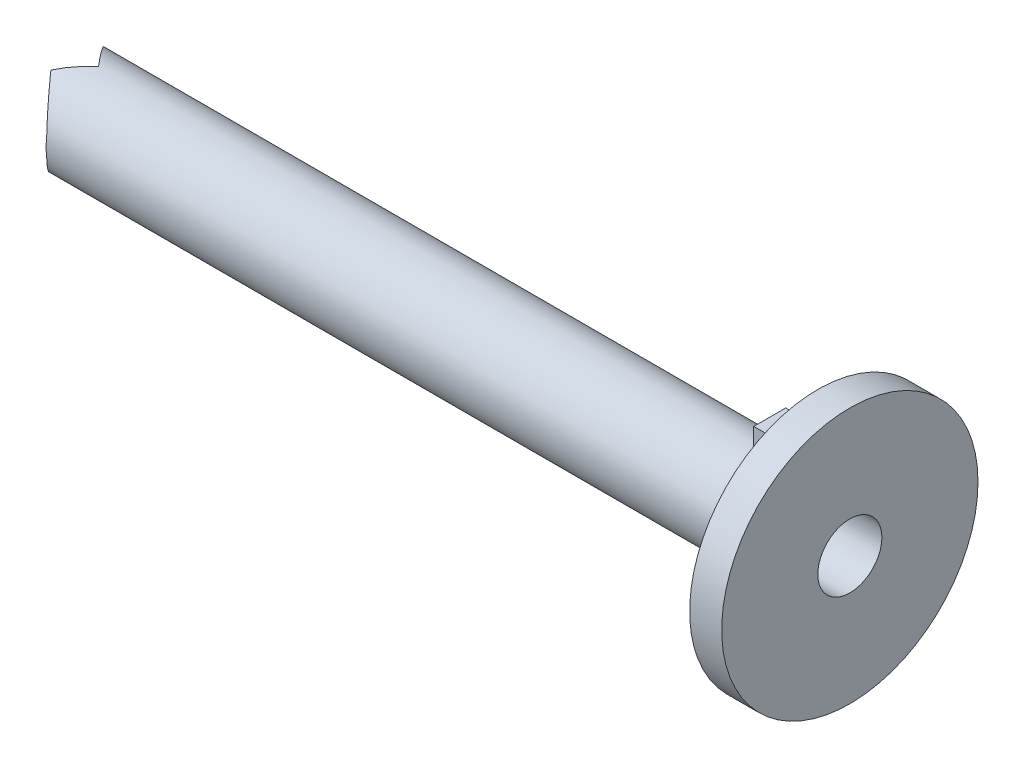
from build123d import *

# Parameters (mm, degrees)
SKETCH1_R                = 19.05
SKETCH1_R_2              = 12.7
BOSS_EXTRUDE1_DEPTH      = 381
SKETCH2_R                = 50.8
SKETCH2_R_2              = 12.7
BOSS_EXTRUDE2_DEPTH      = 12.7
CUT_EXTRUDE1_DEPTH       = 388.714173071
CUT_EXTRUDE1_DEPTH_BACK  = 388.714173071
BOSS_EXTRUDE3_REACH      = 355.664
BOSS_EXTRUDE3_END_RADIUS = 19.05
BOSS_EXTRUDE3_START      = 31.75
SKETCH4_W                = 12.7
SKETCH4_H                = 12.7
SKETCH4_R                = 2.286


with BuildPart() as part:
    # Sketch1 → Boss-Extrude1 (new body)
    with BuildSketch(Plane(origin=(0, 0, 0), x_dir=(0, 0, -1), z_dir=(1, 0, 0))):
        Circle(SKETCH1_R)
        Circle(SKETCH1_R_2, mode=Mode.SUBTRACT)
    extrude(amount=-BOSS_EXTRUDE1_DEPTH)

    # Sketch2 → Boss-Extrude2 (add)
    with BuildSketch(Plane(origin=(0, 0, 0), x_dir=(0, 0, -1), z_dir=(1, 0, 0))):
        Circle(SKETCH2_R)
        Circle(SKETCH2_R_2, mode=Mode.SUBTRACT)
    extrude(amount=-BOSS_EXTRUDE2_DEPTH)

    # Sketch3 → Cut-Extrude1 (cut, two sides: drawn at the far end of the back side and taken through both)
    with BuildSketch(Plane(origin=(0, 0, 0), x_dir=(1, 0, 0), z_dir=(0, 1, 0)).offset(-CUT_EXTRUDE1_DEPTH_BACK)):
        Polygon((-330.049521684, 38.465573285), (-297.845785911, 0), (-308.119579729, -8.601315755), (-299.508024312, -18.88734028), (-330.049521684, -60.531095944), (-403.402475389, -60.531095944), (-403.402475389, 38.465573285), align=None)
    extrude(amount=CUT_EXTRUDE1_DEPTH + CUT_EXTRUDE1_DEPTH_BACK, mode=Mode.SUBTRACT)

    # Boss-Extrude3: up to this cylinder (the profile starts outside it)
    boss_extrude3_end = Plane(origin=(-25.4, 0, 0), z_dir=(1, 0, 0)) * Cylinder(BOSS_EXTRUDE3_END_RADIUS, 750.428, mode=Mode.PRIVATE)
    # Sketch4 → Boss-Extrude3 (add, up to the surface)
    with BuildSketch(Plane(origin=(0, 0, 0), x_dir=(1, 0, 0), z_dir=(0, 1, 0)).offset(BOSS_EXTRUDE3_START), mode=Mode.PRIVATE) as boss_extrude3_sk1:
        with Locations((-25.4, 0)):
            Rectangle(SKETCH4_W, SKETCH4_H)
        with Locations(Location((-25.4, 0, 0), (0, 0, 270))):
            Circle(SKETCH4_R, mode=Mode.SUBTRACT)
    boss_extrude3_tool1 = extrude(boss_extrude3_sk1.sketch, amount=-BOSS_EXTRUDE3_REACH, mode=Mode.PRIVATE) - boss_extrude3_end
    add(boss_extrude3_tool1.solids().sort_by_distance((-25.4, 31.75, 6.170395))[0])


solid = part.part
